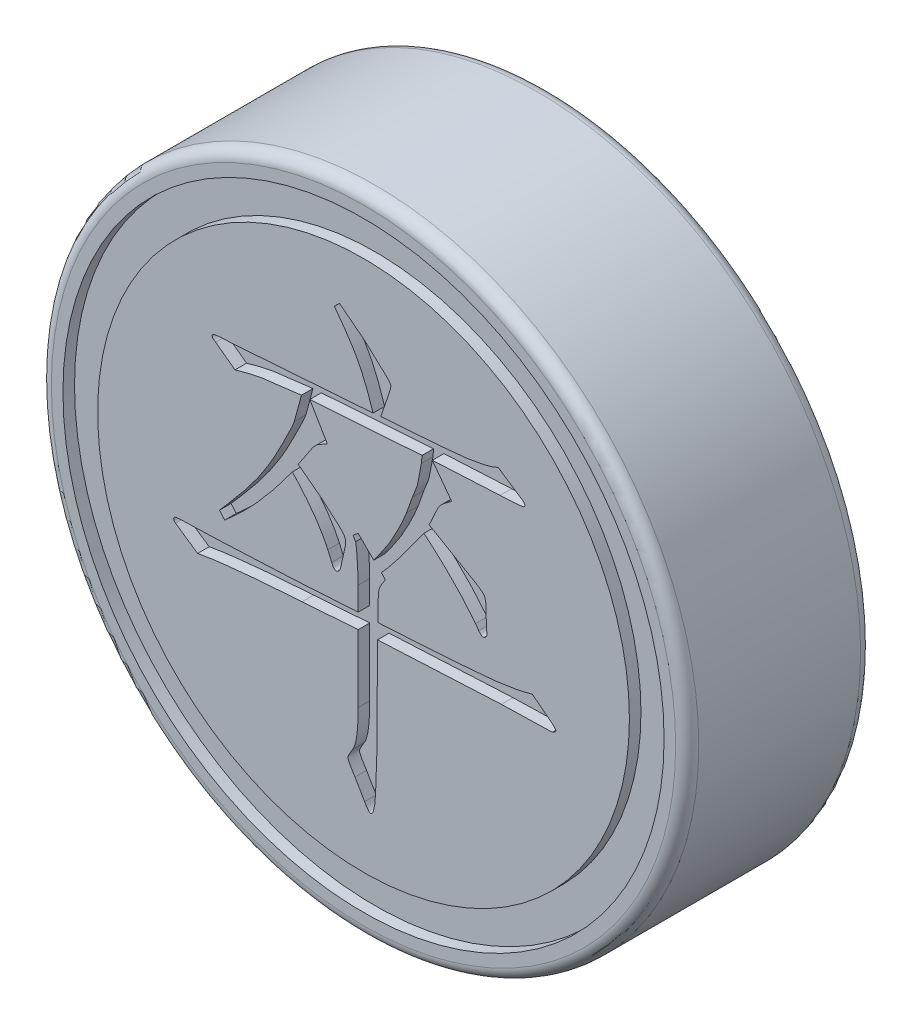
from build123d import *

# Parameters (mm, degrees)
SKETCH_1_R          = 14
EXTRUDE_1_DEPTH     = 8
SKETCH_2_R          = 13
SKETCH_2_R_2        = 11.5
CUT_EXTRUDE_1_DEPTH = 0.5
SKETCH_3_R          = 5.1
CUT_EXTRUDE_2_DEPTH = 5
CHAMFER_1_SIZE      = 0.5
FILLET_1_R          = 0.5
CUT_EXTRUDE_3_DEPTH = 0.5


with BuildPart() as part:
    # 草图1 → 凸台-拉伸1 (new body)
    with BuildSketch(Plane.XY):
        Circle(SKETCH_1_R)
    extrude(amount=EXTRUDE_1_DEPTH)

    # 草图2 → 切除-拉伸1 (cut)
    with BuildSketch(Plane.XY.offset(8)):
        Circle(SKETCH_2_R)
        Circle(SKETCH_2_R_2, mode=Mode.SUBTRACT)
    extrude(amount=-CUT_EXTRUDE_1_DEPTH, mode=Mode.SUBTRACT)

    # 草图3 → 切除-拉伸2 (cut)
    with BuildSketch(Plane(origin=(0, 0, 0), x_dir=(-1, 0, 0), z_dir=(0, 0, -1))):
        Circle(SKETCH_3_R)
    extrude(amount=-CUT_EXTRUDE_2_DEPTH, mode=Mode.SUBTRACT)

    # 倒角1
    chamfer_1_edges = [part.edges().sort_by_distance(p)[0] for p in [
        (5.1, 0, 0),
    ]]
    chamfer(chamfer_1_edges, length=CHAMFER_1_SIZE)

    # 圆角1
    fillet_1_edges = [part.edges().sort_by_distance(p)[0] for p in [
        (-14, 0, 0),
        (-14, 0, 8),
    ]]
    fillet(fillet_1_edges, radius=FILLET_1_R)

    # 草图4 → 切除-拉伸3 (cut)
    with BuildSketch(Plane.XY.offset(8)):
        with BuildLine():
            Line((-0.231000771, -1.867496322), (-0.231000771, -0.85641599))
            add(Edge.make_bspline(
                [(-0.231000771, -0.85641599), (-0.231149955, -0.76590718), (-0.231436273, -0.592200311), (-0.244892496, -0.328146644), (-0.261717122, -0.045529461), (-0.28217837, 0.208247107), (-0.29832262, 0.414327271), (-0.312704984, 0.5435358), (-0.32458126, 0.640040714), (-0.336886242, 0.69303946), (-0.341804095, 0.714221129)],
                knots=[0, 0, 0, 0, 1.377939385, 2.644577196, 4.025024859, 5.688908629, 6.521414653, 7.171978256, 7.669069869, 8, 8, 8, 8], degree=3))
            Line((-0.341804095, 0.714221129), (-0.452607419, 0.899816697))
            Line((-0.452607419, 0.899816697), (-0.231000771, 1.088182348))
            Line((-0.231000771, 1.088182348), (0.43935934, 0.415052154))
            Line((0.43935934, 0.415052154), (0.633265157, 0.675439966))
            add(Edge.make_bspline(
                [(0.633265157, 0.675439966), (0.785277714, 0.890606238), (1.087876912, 1.318920469), (1.396400885, 1.883774609), (1.60002397, 2.31069506), (1.724080568, 2.562354765), (1.805896136, 2.752470568), (1.844998024, 2.858155673), (1.860411972, 2.899816697)],
                knots=[0, 0, 0, 0, 1.860529633, 3.703607037, 4.538261894, 5.203716863, 5.686105519, 6, 6, 6, 6], degree=3))
            Line((1.860411972, 2.899816697), (2.112489534, 3.611728054))
            add(Edge.make_bspline(
                [(2.112489534, 3.611728054), (2.140825469, 3.681085585), (2.191078085, 3.804088316), (2.258955822, 3.960426321), (2.297521131, 4.069499882), (2.324506072, 4.141534306), (2.335828083, 4.212172967), (2.356571896, 4.308051802), (2.387694286, 4.445133524), (2.419914442, 4.61174082), (2.452225934, 4.777202823), (2.482173114, 4.912166417), (2.496320348, 5.004881358), (2.501314538, 5.052161062), (2.503071252, 5.068791766)],
                knots=[0, 0, 0, 0, 1.780564775, 3.157758468, 4.046281803, 4.531955915, 4.979456471, 5.74108015, 6.864340489, 8.318717297, 9.773094105, 10.870339483, 11.602640284, 12, 12, 12, 12], degree=3))
            Line((2.503071252, 5.068791766), (2.530772083, 5.387351323))
            Line((2.530772083, 5.387351323), (-2.322413513, 5.052171268))
            Line((-2.322413513, 5.052171268), (-1.737925978, 4.060481517))
            Line((-1.737925978, 4.060481517), (-1.568950909, 3.780703124))
            add(Edge.make_bspline(
                [(-1.568950909, 3.780703124), (-1.576957799, 3.77201867), (-1.599101517, 3.748001093), (-1.653744052, 3.719029289), (-1.728803219, 3.675935333), (-1.859223323, 3.609855321), (-2.029201921, 3.509784597), (-2.133025383, 3.390440375), (-2.183909358, 3.331949661)],
                knots=[0, 0, 0, 0, 0.275629864, 0.762277314, 1.431149214, 2.312664845, 4.192833594, 6, 6, 6, 6], degree=3))
            Line((-2.183909358, 3.331949661), (-2.823798555, 2.376270991))
            Line((-2.823798555, 2.376270991), (-1.821028471, 1.611728054))
            Line((-1.821028471, 1.611728054), (-1.039865037, 0.93859786))
            add(Edge.make_bspline(
                [(-1.039865037, 0.93859786), (-1.002363604, 0.900380695), (-0.933558255, 0.830262163), (-0.84714904, 0.726408178), (-0.794888429, 0.627771392), (-0.764746244, 0.511173599), (-0.771173823, 0.368759201), (-0.80042314, 0.26218703), (-0.815488305, 0.207295921)],
                knots=[0, 0, 0, 0, 1.170109199, 2.146845219, 2.940851813, 3.586744449, 4.757027552, 6, 6, 6, 6], degree=3))
            Line((-0.815488305, 0.207295921), (-0.984463374, -0.557247015))
            add(Edge.make_bspline(
                [(-0.984463374, -0.557247015), (-0.994570052, -0.590746193), (-1.012541487, -0.650313576), (-1.04945927, -0.727818031), (-1.102497189, -0.775935099), (-1.164103788, -0.798411444), (-1.229091766, -0.785891445), (-1.285515445, -0.739697463), (-1.337686488, -0.669916262), (-1.361778284, -0.609762769), (-1.375045092, -0.576637597)],
                knots=[0, 0, 0, 0, 1.322540561, 2.351707903, 3.191055306, 3.9625373, 4.741851799, 5.564388626, 6.658763748, 8, 8, 8, 8], degree=3))
            Line((-1.375045092, -0.576637597), (-1.541250078, -0.183285796))
            add(Edge.make_bspline(
                [(-1.541250078, -0.183285796), (-1.580982356, -0.099727762), (-1.66243411, 0.071567438), (-1.805057246, 0.326157588), (-1.96663328, 0.587784195), (-2.147637871, 0.854790891), (-2.352866721, 1.124327685), (-2.57379367, 1.401111158), (-2.814844249, 1.684730674), (-2.987443567, 1.870908891), (-3.075876117, 1.966298691)],
                knots=[0, 0, 0, 0, 0.836983521, 1.715828529, 2.638647462, 3.618870012, 4.633145329, 5.703083065, 6.823157458, 8, 8, 8, 8], degree=3))
            add(Edge.make_bspline(
                [(-3.075876117, 1.966298691), (-3.290739125, 1.673064117), (-3.706828957, 1.105204968), (-4.36047653, 0.319895698), (-5.001269427, -0.388810379), (-5.453218344, -0.805027906), (-5.671443984, -1.006000478)],
                knots=[0, 0, 0, 0, 1.10305892, 2.136112702, 3.100013337, 4, 4, 4, 4], degree=3))
            Line((-5.671443984, -1.006000478), (-6.003853956, -1.305169453))
            Line((-6.003853956, -1.305169453), (-6.228230688, -1.044781641))
            Line((-6.228230688, -1.044781641), (-5.920751463, -0.690211004))
            add(Edge.make_bspline(
                [(-5.920751463, -0.690211004), (-5.802870533, -0.555000226), (-5.570778312, -0.288787789), (-5.239460097, 0.112265487), (-4.927809736, 0.505671869), (-4.636127886, 0.899324566), (-4.352523949, 1.302269826), (-4.086387345, 1.736831165), (-3.819323748, 2.198582423), (-3.609002864, 2.600777244), (-3.448366676, 2.918932421), (-3.340565165, 3.13511285), (-3.245711929, 3.324563086), (-3.16989425, 3.489734367), (-3.100742838, 3.625157078), (-3.051268122, 3.737230352), (-3.018507127, 3.824056086), (-3.000169947, 3.872119865), (-2.992773624, 3.891506448)],
                knots=[0, 0, 0, 0, 1.575646389, 3.102242839, 4.569128668, 5.983685395, 7.405663771, 8.8956218, 10.457997719, 12.090688862, 12.881450112, 13.588774981, 14.212682332, 14.742380946, 15.184927268, 15.5481111, 15.817730078, 16, 16, 16, 16], degree=3))
            Line((-2.992773624, 3.891506448), (-2.685294399, 5.032780686))
            add(Edge.make_bspline(
                [(-2.685294399, 5.032780686), (-2.810825032, 5.014888307), (-3.05246243, 4.980446772), (-3.401548702, 4.936381186), (-3.722822239, 4.89924848), (-4.030041884, 4.872895859), (-4.350079202, 4.837928649), (-4.706659636, 4.768433283), (-5.115805472, 4.670507111), (-5.40396731, 4.588855213), (-5.557870577, 4.54524606)],
                knots=[0, 0, 0, 0, 1.042444008, 2.006629391, 2.892733381, 3.700984575, 4.541839399, 5.537921592, 6.68503785, 8, 8, 8, 8], degree=3))
            Line((-5.557870577, 4.54524606), (-6.394435674, 5.162974592))
            add(Edge.make_bspline(
                [(-6.394435674, 5.162974592), (-6.418849511, 5.178015677), (-6.462190549, 5.204717593), (-6.515202443, 5.248880153), (-6.545541066, 5.293840365), (-6.555101521, 5.342104834), (-6.526378237, 5.386877298), (-6.468578725, 5.414867421), (-6.385089075, 5.431963549), (-6.320659509, 5.438815324), (-6.28363235, 5.442752985)],
                knots=[0, 0, 0, 0, 1.259125921, 2.235282543, 3.000051951, 3.613422966, 4.266993076, 5.156868119, 6.366074726, 8, 8, 8, 8], degree=3))
            Line((-6.28363235, 5.442752985), (-5.111887197, 5.517545229))
            Line((-5.111887197, 5.517545229), (0.411658509, 5.910897029))
            add(Edge.make_bspline(
                [(0.411658509, 5.910897029), (0.356575526, 6.080293028), (0.251159725, 6.404476906), (0.080683562, 6.862027314), (-0.095866273, 7.267157586), (-0.281755563, 7.631195812), (-0.486204796, 7.976192822), (-0.713602503, 8.328841462), (-0.974577601, 8.696630552), (-1.163719939, 8.943813698), (-1.261471685, 9.071561849)],
                knots=[0, 0, 0, 0, 1.187278199, 2.272169673, 3.25333475, 4.13144196, 4.99493188, 5.925384511, 6.927805969, 8, 8, 8, 8], degree=3))
            Line((-1.261471685, 9.071561849), (-1.039865037, 9.295938581))
            Line((-1.039865037, 9.295938581), (0.021076792, 8.473223899))
            Line((0.021076792, 8.473223899), (0.996146044, 7.575716974))
            add(Edge.make_bspline(
                [(0.996146044, 7.575716974), (1.02145879, 7.550232782), (1.067101879, 7.504280546), (1.123274653, 7.437864763), (1.160914327, 7.382898345), (1.183151178, 7.330890164), (1.179231933, 7.267169639), (1.16052614, 7.181580525), (1.126575168, 7.062269239), (1.096325153, 6.972598131), (1.079248537, 6.921977362)],
                knots=[0, 0, 0, 0, 1.177952422, 2.124044039, 2.846421886, 3.363909204, 3.939298643, 4.895514331, 6.247468393, 8, 8, 8, 8], degree=3))
            Line((1.079248537, 6.921977362), (0.746838565, 5.949678193))
            Line((0.746838565, 5.949678193), (3.311935517, 6.135273761))
            add(Edge.make_bspline(
                [(3.311935517, 6.135273761), (3.463422196, 6.146627721), (3.753719391, 6.16838556), (4.168432948, 6.209781404), (4.54267807, 6.256033621), (4.876113448, 6.308860487), (5.17089409, 6.364637982), (5.424218901, 6.43253965), (5.64079282, 6.497041793), (5.764942251, 6.556759288), (5.821630808, 6.584027223)],
                knots=[0, 0, 0, 0, 1.422906239, 2.72674598, 3.903599465, 4.954423888, 5.889049996, 6.711399591, 7.411605041, 8, 8, 8, 8], degree=3))
            Line((5.821630808, 6.584027223), (6.910273468, 5.855495367))
            add(Edge.make_bspline(
                [(6.910273468, 5.855495367), (6.925534299, 5.837735333), (6.95440837, 5.804132674), (6.987166423, 5.747053391), (6.967107302, 5.677507203), (6.910983956, 5.649825354), (6.852616066, 5.637267886), (6.790134718, 5.630374601), (6.703787487, 5.617862116), (6.591705734, 5.611389488), (6.456048666, 5.602397424), (6.295243911, 5.595412859), (6.10985021, 5.58236018), (5.977702703, 5.578021673), (5.907503385, 5.575716974)],
                knots=[0, 0, 0, 0, 0.675379518, 1.27784368, 1.770459869, 2.5531393, 2.904947507, 3.490437432, 4.340816645, 5.398544614, 6.693051866, 8.224506501, 9.994384636, 12, 12, 12, 12], degree=3))
            Line((5.907503385, 5.575716974), (2.976755462, 5.426132486))
            Line((2.976755462, 5.426132486), (3.813320559, 4.30424883))
            add(Edge.make_bspline(
                [(3.813320559, 4.30424883), (3.741331514, 4.254572415), (3.609337397, 4.163489186), (3.441698136, 4.024131221), (3.309359229, 3.905911198), (3.253316596, 3.818771984), (3.228833024, 3.780703124)],
                knots=[0, 0, 0, 0, 1.326860404, 2.432839172, 3.315348105, 4, 4, 4, 4], degree=3))
            Line((3.228833024, 3.780703124), (2.838251307, 2.93859786))
            Line((2.838251307, 2.93859786), (4.95736488, 1.703140797))
            add(Edge.make_bspline(
                [(4.95736488, 1.703140797), (4.990616942, 1.680138881), (5.051485135, 1.63803367), (5.132590453, 1.580725017), (5.185648269, 1.526041361), (5.237872447, 1.465726294), (5.268747589, 1.359355272), (5.283670173, 1.270951666), (5.292544936, 1.218376254)],
                knots=[0, 0, 0, 0, 1.17441112, 2.149769931, 2.869757621, 3.384475975, 4.44449496, 6, 6, 6, 6], degree=3))
            Line((5.292544936, 1.218376254), (5.320245767, 0.226686503))
            add(Edge.make_bspline(
                [(5.320245767, 0.226686503), (5.322744111, 0.216451886), (5.32988551, 0.18719672), (5.355998408, 0.135449112), (5.345581024, 0.037649417), (5.282875736, -0.038512642), (5.211859508, -0.102477819), (5.129698821, -0.100052662), (5.054513838, -0.042827401), (5.010422729, 0.01045053), (4.985065711, 0.041090935)],
                knots=[0, 0, 0, 0, 0.386160195, 1.103820623, 2.088339808, 3.769868534, 4.643911825, 5.456755575, 6.537367406, 8, 8, 8, 8], degree=3))
            Line((4.985065711, 0.041090935), (4.846561556, 0.246077085))
            add(Edge.make_bspline(
                [(4.846561556, 0.246077085), (4.691072542, 0.438372794), (4.373280367, 0.831391374), (3.838259647, 1.3955836), (3.252520811, 1.961827266), (2.830043857, 2.323948157), (2.613874576, 2.50923498)],
                knots=[0, 0, 0, 0, 0.931487566, 1.903796615, 2.927433146, 4, 4, 4, 4], degree=3))
            add(Edge.make_bspline(
                [(2.613874576, 2.50923498), (2.532847234, 2.395496926), (2.376270179, 2.175709763), (2.145472897, 1.859624305), (1.929624535, 1.565828538), (1.727271658, 1.29445775), (1.539987878, 1.045229251), (1.364612296, 0.820570264), (1.204344065, 0.618015209), (1.100651686, 0.491557333), (1.051547706, 0.431672653)],
                knots=[0, 0, 0, 0, 1.289080824, 2.491016928, 3.612757755, 4.654336516, 5.615794729, 6.490441643, 7.285142027, 8, 8, 8, 8], degree=3))
            Line((1.051547706, 0.431672653), (0.774539396, 0.115883179))
            Line((0.774539396, 0.115883179), (0.940744382, -0.072482472))
            add(Edge.make_bspline(
                [(0.940744382, -0.072482472), (0.90277084, -0.127256992), (0.832726642, -0.228291479), (0.751098133, -0.375837303), (0.687548667, -0.499483523), (0.651676072, -0.643105698), (0.640020825, -0.816486781), (0.635593698, -0.953386028), (0.633265157, -1.025391059)],
                knots=[0, 0, 0, 0, 1.168193513, 2.154794477, 2.959264109, 3.59582033, 4.73547125, 6, 6, 6, 6], degree=3))
            Line((0.633265157, -1.025391059), (0.633265157, -1.828715159))
            Line((0.633265157, -1.828715159), (2.865952138, -1.698521253))
            Line((2.865952138, -1.698521253), (4.649885656, -1.568327347))
            add(Edge.make_bspline(
                [(4.649885656, -1.568327347), (4.787507666, -1.558697962), (5.055559989, -1.539942394), (5.446214574, -1.503794237), (5.813829002, -1.462614864), (6.157562222, -1.416254505), (6.476729646, -1.362213564), (6.773245169, -1.309489551), (7.045186283, -1.244518875), (7.217864938, -1.197549344), (7.300855185, -1.174975547)],
                knots=[0, 0, 0, 0, 1.233193512, 2.401944168, 3.50668642, 4.539756726, 5.501835171, 6.400309202, 7.231180392, 8, 8, 8, 8], degree=3))
            Line((7.300855185, -1.174975547), (8.220522775, -1.886886904))
            add(Edge.make_bspline(
                [(8.220522775, -1.886886904), (8.243886776, -1.913378455), (8.283046107, -1.957779729), (8.325579715, -2.020878192), (8.315456656, -2.069548149), (8.286548594, -2.104735114), (8.231734788, -2.133832638), (8.189142771, -2.154825463), (8.165121113, -2.166665297)],
                knots=[0, 0, 0, 0, 1.647834743, 2.761860218, 3.192184055, 3.825134912, 4.773388342, 6, 6, 6, 6], degree=3))
            Line((8.165121113, -2.166665297), (5.962905047, -2.22206696))
            Line((5.962905047, -2.22206696), (0.605564326, -2.485224854))
            Line((0.605564326, -2.485224854), (0.577863495, -6.709601586))
            Line((0.577863495, -6.709601586), (0.522461833, -8.260848123))
            add(Edge.make_bspline(
                [(0.522461833, -8.260848123), (0.517069264, -8.381217376), (0.506149878, -8.624952447), (0.454066958, -8.891602964), (0.404319817, -9.055335349), (0.370676872, -9.107500532), (0.327765959, -9.136374119), (0.275974056, -9.125670669), (0.223603034, -9.08953754), (0.170717692, -9.022405575), (0.10879625, -8.93321892), (0.070191639, -8.862437512), (0.048777623, -8.823174993)],
                knots=[0, 0, 0, 0, 2.682278372, 5.431331435, 6.043327105, 6.471644946, 6.803546198, 7.115033221, 7.577593042, 8.20497218, 9.004296244, 10, 10, 10, 10], degree=3))
            Line((0.048777623, -8.823174993), (-0.369504926, -8.111263635))
            add(Edge.make_bspline(
                [(-0.369504926, -8.111263635), (-0.415726956, -8.039919174), (-0.496991841, -7.914485494), (-0.590128655, -7.744575589), (-0.650265773, -7.630113528), (-0.683805577, -7.547124388), (-0.664236331, -7.472619552), (-0.621657962, -7.388478356), (-0.562016469, -7.271366005), (-0.509666121, -7.186536515), (-0.48030825, -7.138964466)],
                knots=[0, 0, 0, 0, 1.855027127, 3.261400772, 4.207046878, 4.710506158, 5.141015363, 5.826016072, 6.780838243, 8, 8, 8, 8], degree=3))
            add(Edge.make_bspline(
                [(-0.48030825, -7.138964466), (-0.459798588, -7.104415477), (-0.415072197, -7.029072858), (-0.367448988, -6.891589468), (-0.323143608, -6.725189692), (-0.288081322, -6.526877013), (-0.265077444, -6.298109743), (-0.245932503, -6.039475164), (-0.230817949, -5.749476635), (-0.230937862, -5.545265436), (-0.231000771, -5.438133442)],
                knots=[0, 0, 0, 0, 0.55411846, 1.208392398, 2.000921929, 2.934704068, 3.987540745, 5.177841318, 6.519456857, 8, 8, 8, 8], degree=3))
            Line((-0.231000771, -5.438133442), (-0.231000771, -2.521235935))
            Line((-0.231000771, -2.521235935), (-2.657593568, -2.690211004))
            add(Edge.make_bspline(
                [(-2.657593568, -2.690211004), (-2.917081041, -2.707425492), (-3.415836608, -2.740513107), (-4.133282915, -2.793386911), (-4.789983011, -2.844950772), (-5.385647576, -2.899974944), (-5.919346085, -2.95795254), (-6.392064883, -3.016646042), (-6.804575087, -3.072049207), (-7.058462114, -3.117838469), (-7.175599109, -3.138964466)],
                knots=[0, 0, 0, 0, 1.374011097, 2.640958637, 3.800891639, 4.854314732, 5.801437946, 6.637100357, 7.371192888, 8, 8, 8, 8], degree=3))
            Line((-7.175599109, -3.138964466), (-8.125737613, -2.485224854))
            add(Edge.make_bspline(
                [(-8.125737613, -2.485224854), (-8.148261884, -2.465807228), (-8.191394541, -2.428623615), (-8.214706623, -2.357756462), (-8.201533507, -2.302384393), (-8.163583783, -2.272391771), (-8.109232368, -2.251148731), (-8.06508243, -2.24498062), (-8.039865037, -2.241457541)],
                knots=[0, 0, 0, 0, 1.379323769, 2.641323969, 3.272324068, 3.916578826, 4.809999427, 6, 6, 6, 6], degree=3))
            Line((-8.039865037, -2.241457541), (-6.28363235, -2.186055879))
            Line((-6.28363235, -2.186055879), (-3.048175286, -2.036471392))
            Line((-3.048175286, -2.036471392), (-0.231000771, -1.867496322))
        make_face()
    extrude(amount=-CUT_EXTRUDE_3_DEPTH, mode=Mode.SUBTRACT)


solid = part.part
